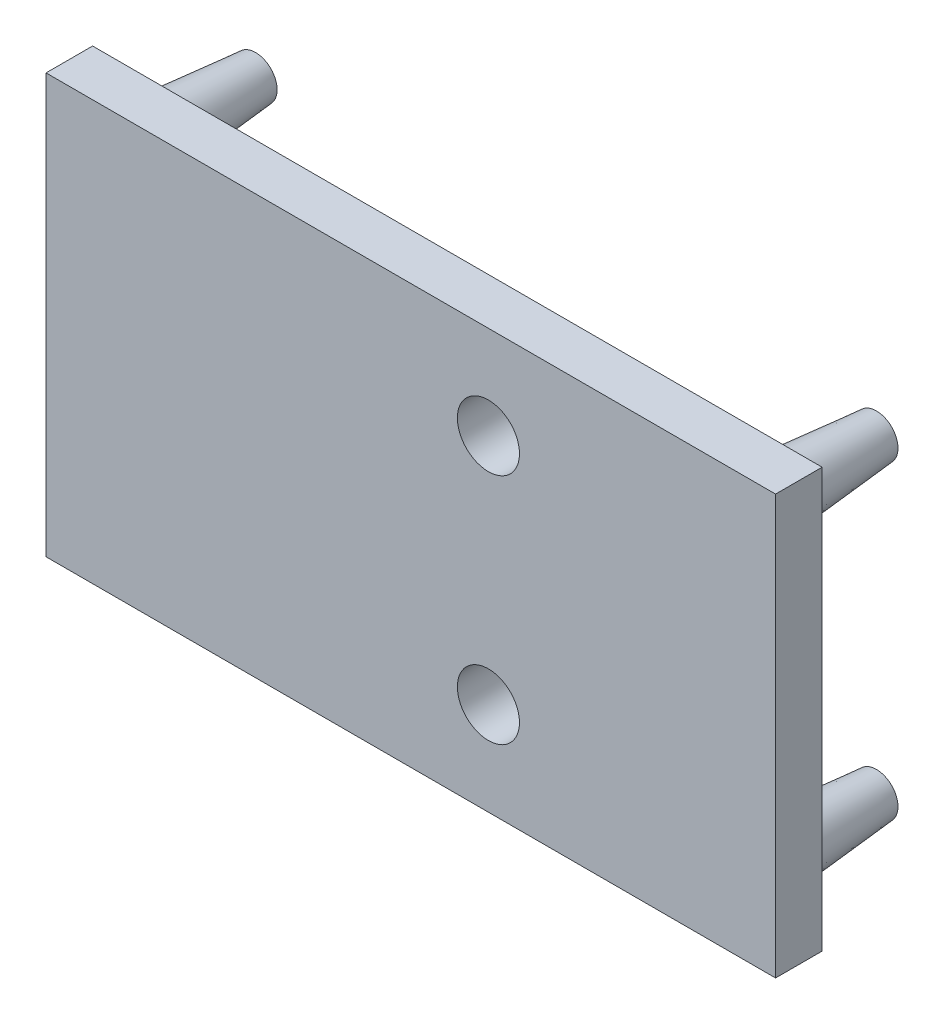
from build123d import *

# Parameters (mm, degrees)
SKETCH1_W                     = 47
SKETCH1_H                     = 27
BOSS_EXTRUDE1_DEPTH           = 3
SKETCH2_R                     = 2
BOSS_EXTRUDE2_DEPTH           = 7
BOSS_EXTRUDE2_DRAFT           = 5
BOSS_EXTRUDE2_PROFILE_2_DEPTH = 7
BOSS_EXTRUDE2_PROFILE_2_DRAFT = 5
BOSS_EXTRUDE2_PROFILE_3_DEPTH = 7
BOSS_EXTRUDE2_PROFILE_3_DRAFT = 5
BOSS_EXTRUDE2_PROFILE_4_DEPTH = 7
BOSS_EXTRUDE2_PROFILE_4_DRAFT = 5
SKETCH3_R                     = 2
CUT_EXTRUDE1_DEPTH            = 5


with BuildPart() as part:
    # Sketch1 → Boss-Extrude1 (new body)
    with BuildSketch(Plane.XY):
        Rectangle(SKETCH1_W, SKETCH1_H)
    extrude(amount=BOSS_EXTRUDE1_DEPTH)


with BuildPart() as boss_extrude2_tool:
    # Sketch2 → Boss-Extrude2 (with draft: the straight prism first)
    with BuildSketch(Plane(origin=(0, 0, 0), x_dir=(-1, 0, 0), z_dir=(0, 0, -1))):
        with Locations((-20, 10)):
            Circle(SKETCH2_R)
    extrude(amount=BOSS_EXTRUDE2_DEPTH)
    # Boss-Extrude2: the draft: its side faces are tilted about the plane it starts from
    boss_extrude2_sides = [boss_extrude2_tool.faces().sort_by_distance(p)[0] for p in [
        (22, 10, -3.5),
    ]]
    draft(boss_extrude2_sides, Plane(origin=(0, 0, 0), x_dir=(-1, 0, 0), z_dir=(0, 0, -1)), BOSS_EXTRUDE2_DRAFT)


with BuildPart() as part_1:
    add(part.part)

    # Boss-Extrude2: add boss_extrude2_tool
    add(boss_extrude2_tool.part)


with BuildPart() as boss_extrude2_profile_2_tool:
    # Sketch2 → Boss-Extrude2 profile 2 (with draft: the straight prism first)
    with BuildSketch(Plane(origin=(0, 0, 0), x_dir=(-1, 0, 0), z_dir=(0, 0, -1))):
        with Locations((20, 10)):
            Circle(SKETCH2_R)
    extrude(amount=BOSS_EXTRUDE2_PROFILE_2_DEPTH)
    # Boss-Extrude2 profile 2: the draft: its side faces are tilted about the plane it starts from
    boss_extrude2_profile_2_sides = [boss_extrude2_profile_2_tool.faces().sort_by_distance(p)[0] for p in [
        (-18, 10, -3.5),
    ]]
    draft(boss_extrude2_profile_2_sides, Plane(origin=(0, 0, 0), x_dir=(-1, 0, 0), z_dir=(0, 0, -1)), BOSS_EXTRUDE2_PROFILE_2_DRAFT)


with BuildPart() as part_2:
    add(part_1.part)

    # Boss-Extrude2 profile 2: add boss_extrude2_profile_2_tool
    add(boss_extrude2_profile_2_tool.part)


with BuildPart() as boss_extrude2_profile_3_tool:
    # Sketch2 → Boss-Extrude2 profile 3 (with draft: the straight prism first)
    with BuildSketch(Plane(origin=(0, 0, 0), x_dir=(-1, 0, 0), z_dir=(0, 0, -1))):
        with Locations((20, -10)):
            Circle(SKETCH2_R)
    extrude(amount=BOSS_EXTRUDE2_PROFILE_3_DEPTH)
    # Boss-Extrude2 profile 3: the draft: its side faces are tilted about the plane it starts from
    boss_extrude2_profile_3_sides = [boss_extrude2_profile_3_tool.faces().sort_by_distance(p)[0] for p in [
        (-18, -10, -3.5),
    ]]
    draft(boss_extrude2_profile_3_sides, Plane(origin=(0, 0, 0), x_dir=(-1, 0, 0), z_dir=(0, 0, -1)), BOSS_EXTRUDE2_PROFILE_3_DRAFT)


with BuildPart() as part_3:
    add(part_2.part)

    # Boss-Extrude2 profile 3: add boss_extrude2_profile_3_tool
    add(boss_extrude2_profile_3_tool.part)


with BuildPart() as boss_extrude2_profile_4_tool:
    # Sketch2 → Boss-Extrude2 profile 4 (with draft: the straight prism first)
    with BuildSketch(Plane(origin=(0, 0, 0), x_dir=(-1, 0, 0), z_dir=(0, 0, -1))):
        with Locations((-20, -10)):
            Circle(SKETCH2_R)
    extrude(amount=BOSS_EXTRUDE2_PROFILE_4_DEPTH)
    # Boss-Extrude2 profile 4: the draft: its side faces are tilted about the plane it starts from
    boss_extrude2_profile_4_sides = [boss_extrude2_profile_4_tool.faces().sort_by_distance(p)[0] for p in [
        (22, -10, -3.5),
    ]]
    draft(boss_extrude2_profile_4_sides, Plane(origin=(0, 0, 0), x_dir=(-1, 0, 0), z_dir=(0, 0, -1)), BOSS_EXTRUDE2_PROFILE_4_DRAFT)


with BuildPart() as part_4:
    add(part_3.part)

    # Boss-Extrude2 profile 4: add boss_extrude2_profile_4_tool
    add(boss_extrude2_profile_4_tool.part)

    # Sketch3 → Cut-Extrude1 (cut)
    with BuildSketch(Plane.XY.offset(3)):
        with Locations((5, 7.5)):
            Circle(SKETCH3_R)
        with Locations((5, -7.5)):
            Circle(SKETCH3_R)
    extrude(amount=-CUT_EXTRUDE1_DEPTH, mode=Mode.SUBTRACT)


solid = part_4.part
